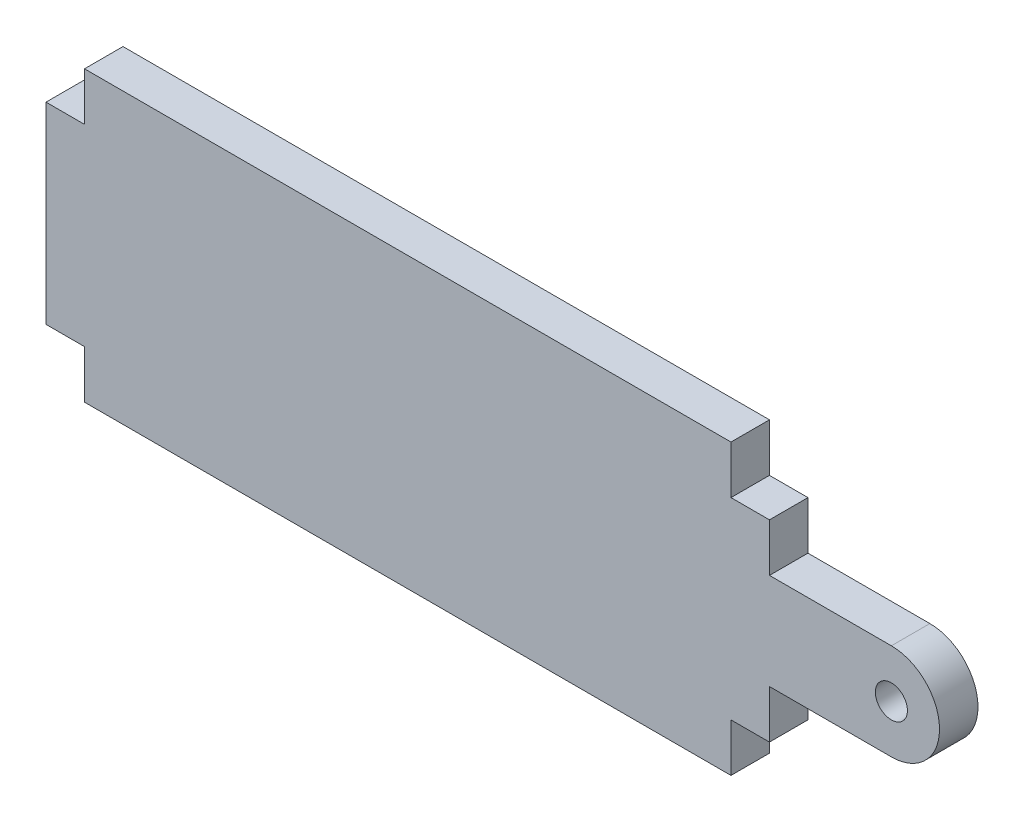
from build123d import *

# Parameters (mm, degrees)
SKETCH1_R           = 1
BOSS_EXTRUDE1_DEPTH = 2.4


with BuildPart() as part:
    # Sketch1 → Boss-Extrude1 (new body)
    with BuildSketch(Plane.XY):
        with BuildLine():
            Line((22.55, -3), (30.15, -3))
            ThreePointArc((30.15, -3), (33.15, 0), (30.15, 3))
            Line((30.15, 3), (22.55, 3))
            Line((22.55, 3), (22.55, 6))
            Line((22.55, 6), (20.15, 6))
            Line((20.15, 6), (20.15, 9))
            Line((20.15, 9), (-20.15, 9))
            Line((-20.15, 9), (-20.15, 6))
            Line((-20.15, 6), (-22.55, 6))
            Line((-22.55, 6), (-22.55, -6))
            Line((-22.55, -6), (-20.15, -6))
            Line((-20.15, -6), (-20.15, -9))
            Line((-20.15, -9), (20.15, -9))
            Line((20.15, -9), (20.15, -6))
            Line((20.15, -6), (22.55, -6))
            Line((22.55, -6), (22.55, -3))
        make_face()
        with Locations((30.15, 0)):
            Circle(SKETCH1_R, mode=Mode.SUBTRACT)
    extrude(amount=BOSS_EXTRUDE1_DEPTH)


solid = part.part
